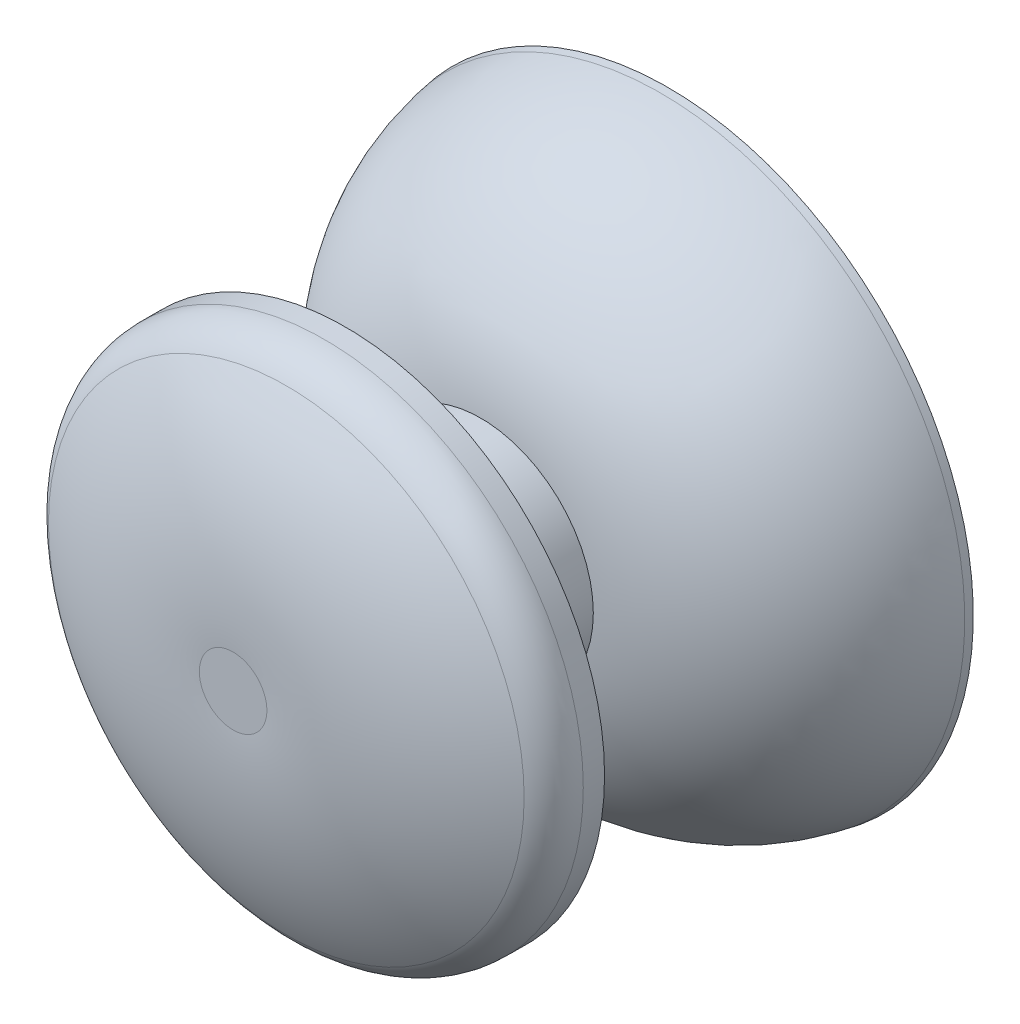
from build123d import *


with BuildPart() as part:
    # 스케치1 → 회전1 (revolve)
    with BuildSketch(Plane.XZ.offset(-12.361086828), mode=Mode.PRIVATE) as revolve_1_sk:
        with BuildLine():
            Line((56.788605182, 33.75), (55.288605182, 33.75))
            Line((55.288605182, 33.75), (55.288605182, 24.584215849))
            Line((55.288605182, 24.584215849), (56.902385075, 24.584215849))
            Line((56.902385075, 24.584215849), (56.902385075, 19.667107924))
            Line((56.902385075, 19.667107924), (64.110728948, 19.667107924))
            ThreePointArc((64.110728948, 19.667107924), (66.132282487, 17.494751384), (67.260179418, 14.75))
            Line((67.260179418, 14.75), (67.329630852, 14.424330444))
            Line((67.329630852, 14.424330444), (68.842352891, 14.424330444))
            Line((68.842352891, 14.424330444), (68.788605182, 14.75))
            ThreePointArc((68.788605182, 14.75), (65.860000911, 20.153982961), (60.288605182, 22.75))
            Line((60.288605182, 22.75), (60.288605182, 28.75))
            Line((60.288605182, 28.75), (66.788605182, 28.75))
            Line((66.788605182, 28.75), (66.788605182, 29.69501927))
            ThreePointArc((66.788605182, 29.69501927), (66.539331768, 30.661950717), (65.853648759, 31.387851861))
            ThreePointArc((65.853648759, 31.387851861), (61.503658583, 33.269414183), (56.788605182, 33.75))
        make_face()
    revolve(revolve_1_sk.sketch.rotate(Axis((55.288605182, 12.361086828, 33.770778283), (0, 0, -1)), 180), axis=Axis((55.288605182, 12.361086828, 33.770778283), (0, 0, -1)))


solid = part.part
